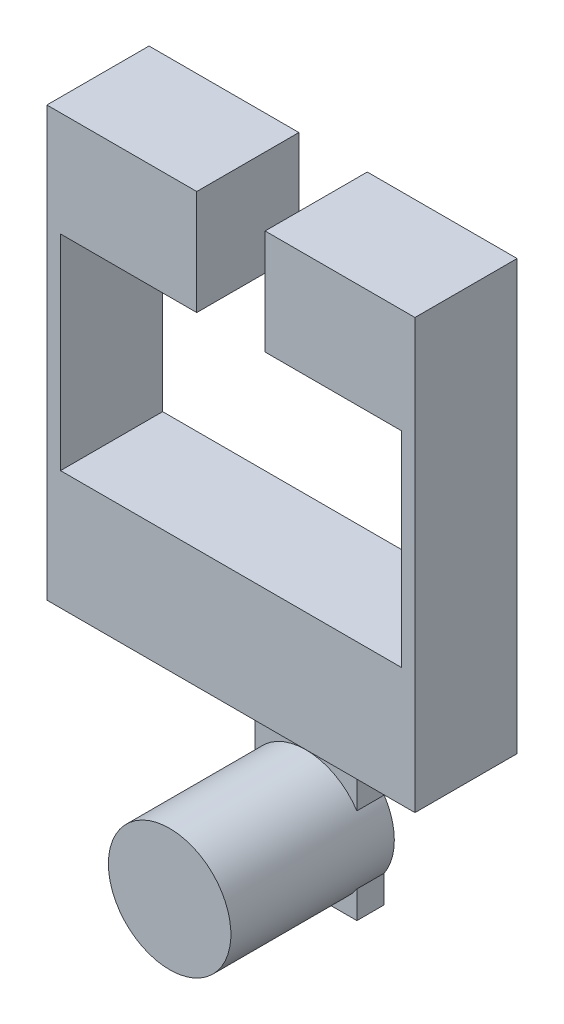
from build123d import *

# Parameters (mm, degrees)
SKETCH1_W            = 68.64096
SKETCH1_H            = 79.975020836
MAIN_BODY_DEPTH      = 9.525
SKETCH2_W            = 63.56096
SKETCH2_H            = 38.227
LOWER_T_CAVITY_DEPTH = 90.088729956
SKETCH3_W            = 12.7508
SKETCH3_H            = 19.558
TOP_SLOT_DEPTH       = 90.088729956
SKETCH4_W            = 19.05
SKETCH4_H            = 36.82365
HANGER_DEPTH         = 5.08
SKETCH5_R            = 11.42365
STRAP_PIN_DEPTH      = 30.48


with BuildPart() as part:
    # Sketch1 → Main-Body (new, symmetric)
    with BuildSketch(Plane.XY):
        with Locations((0, 39.987510418)):
            Rectangle(SKETCH1_W, SKETCH1_H)
    extrude(amount=MAIN_BODY_DEPTH, both=True)

    # Sketch2 → Lower-T-Cavity (cut, through all)
    with BuildSketch(Plane.XY.offset(9.525)):
        with Locations((0, 41.303520836)):
            Rectangle(SKETCH2_W, SKETCH2_H)
    extrude(amount=-LOWER_T_CAVITY_DEPTH, mode=Mode.SUBTRACT)

    # Sketch3 → Top-Slot (cut, through all)
    with BuildSketch(Plane.XY.offset(9.525)):
        with Locations((0, 70.196020836)):
            Rectangle(SKETCH3_W, SKETCH3_H)
    extrude(amount=-TOP_SLOT_DEPTH, mode=Mode.SUBTRACT)

    # Sketch4 → Hanger (add)
    with BuildSketch(Plane(origin=(0, 0, -9.525), x_dir=(-1, 0, 0), z_dir=(0, 0, -1))):
        with Locations((0, -18.411825)):
            Rectangle(SKETCH4_W, SKETCH4_H)
    extrude(amount=-HANGER_DEPTH)

    # Sketch5 → Strap-Pin (add)
    with BuildSketch(Plane(origin=(0, 0, -9.525), x_dir=(-1, 0, 0), z_dir=(0, 0, -1))):
        with Locations((0, -25.4)):
            Circle(SKETCH5_R)
    extrude(amount=-STRAP_PIN_DEPTH)


solid = part.part
